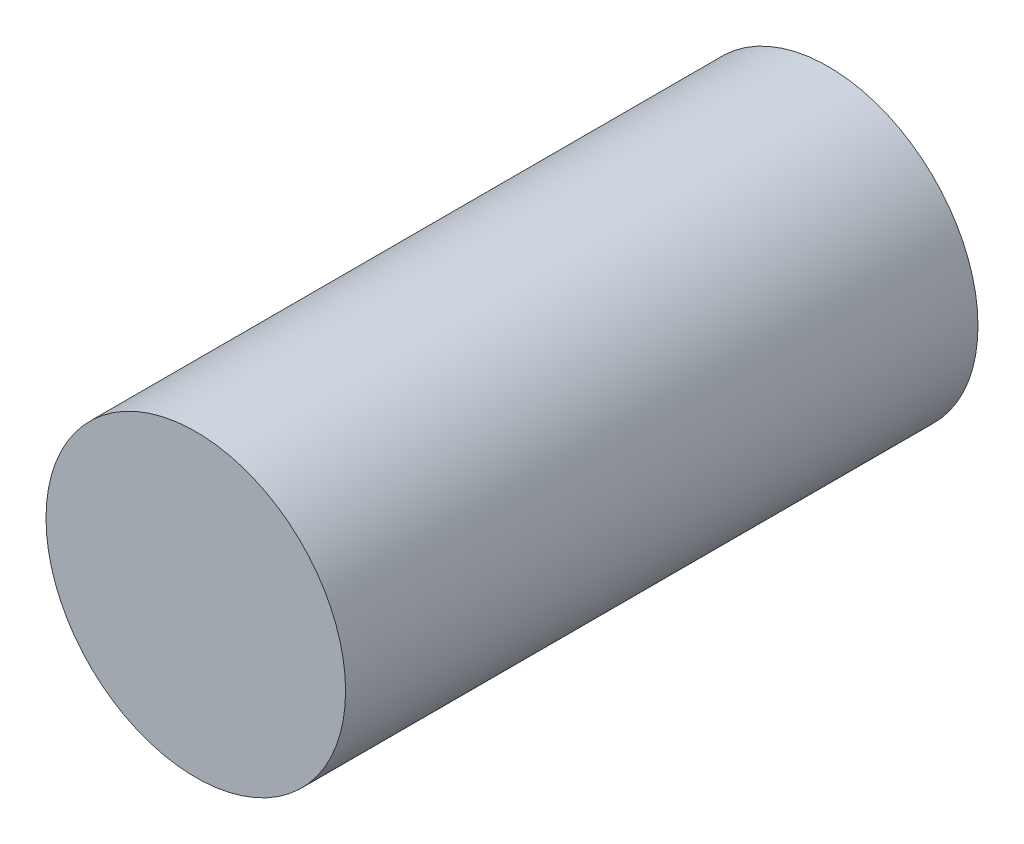
from build123d import *

# Parameters (mm, degrees)
SKETCH_1_R      = 4.5
EXTRUDE_1_DEPTH = 19


with BuildPart() as part:
    # 草图1 → 凸台-拉伸1 (new body)
    with BuildSketch(Plane.XY):
        Circle(SKETCH_1_R)
    extrude(amount=EXTRUDE_1_DEPTH)


solid = part.part
